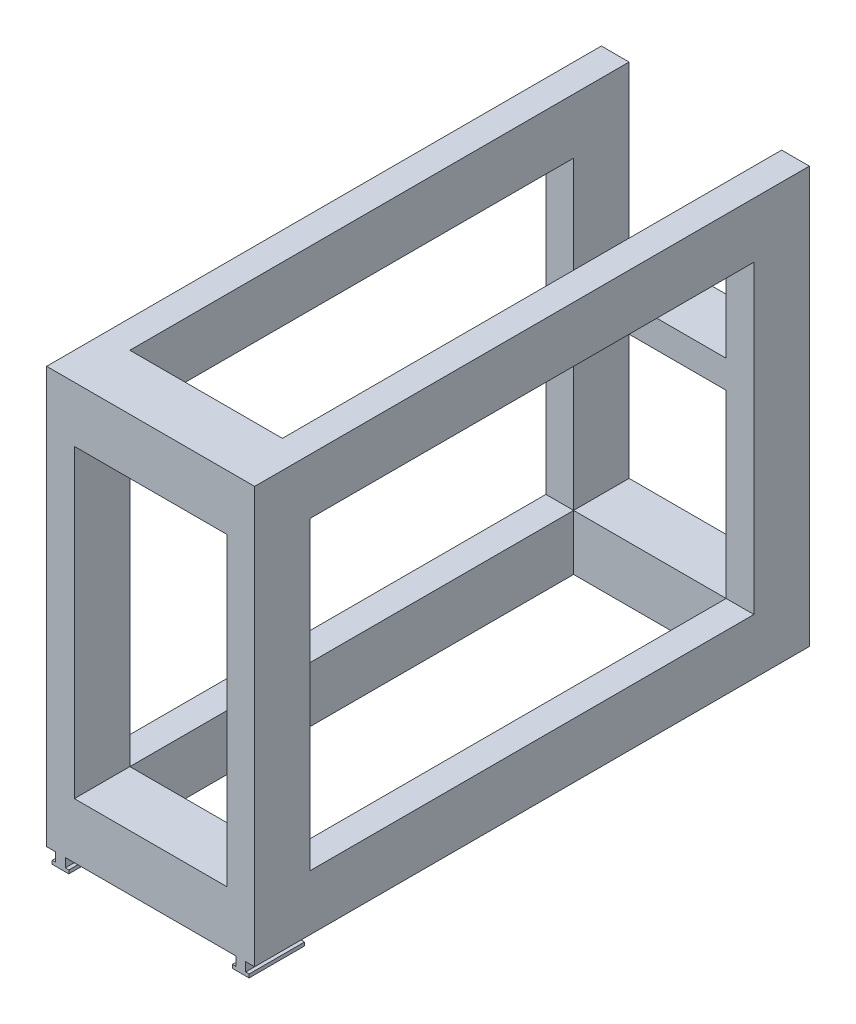
from build123d import *

# Parameters (mm, degrees)
SKETCH3_W           = 190.5
SKETCH3_H           = 508
BOSS_EXTRUDE1_DEPTH = 381
SKETCH4_W           = 406.4
SKETCH4_H           = 279.4
CUT_EXTRUDE1_DEPTH  = 381
SKETCH5_W           = 139.7
SKETCH5_H           = 279.4
CUT_EXTRUDE2_DEPTH  = 924.052
SKETCH6_W           = 139.7
SKETCH6_H           = 406.4
CUT_EXTRUDE3_DEPTH  = 924.052
SKETCH7_W           = 8.89
SKETCH7_H           = 50.8
BOSS_EXTRUDE2_DEPTH = 11.43
SKETCH8_W           = 50.8
SKETCH8_H           = 3.175
BOSS_EXTRUDE3_DEPTH = 3.175
SKETCH9_W           = 50.8
SKETCH9_H           = 3.175
BOSS_EXTRUDE4_DEPTH = 3.175
BOSS_EXTRUDE6_REACH = 488.76
SKETCH11_W          = 50.8
SKETCH11_H          = 25.4
CUT_EXTRUDE4_REACH  = 479.064
SKETCH12_W          = 139.7
SKETCH12_H          = 50.8


with BuildPart() as part:
    # Sketch3 → Boss-Extrude1 (new body)
    with BuildSketch(Plane(origin=(0, 0, 0), x_dir=(1, 0, 0), z_dir=(0, 1, 0))):
        Rectangle(SKETCH3_W, SKETCH3_H)
    extrude(amount=BOSS_EXTRUDE1_DEPTH)

    # Sketch4 → Cut-Extrude1 (cut)
    with BuildSketch(Plane(origin=(95.25, 0, 0), x_dir=(0, 0, -1), z_dir=(1, 0, 0))):
        with Locations((0, 190.5)):
            Rectangle(SKETCH4_W, SKETCH4_H)
    extrude(amount=-CUT_EXTRUDE1_DEPTH, mode=Mode.SUBTRACT)

    # Sketch5 → Cut-Extrude2 (cut)
    with BuildSketch(Plane(origin=(0, 0, -254), x_dir=(-1, 0, 0), z_dir=(0, 0, -1))):
        with Locations((0, 190.5)):
            Rectangle(SKETCH5_W, SKETCH5_H)
    extrude(amount=-CUT_EXTRUDE2_DEPTH, mode=Mode.SUBTRACT)

    # Sketch6 → Cut-Extrude3 (cut)
    with BuildSketch(Plane(origin=(0, 381, 0), x_dir=(1, 0, 0), z_dir=(0, 1, 0))):
        Rectangle(SKETCH6_W, SKETCH6_H)
    extrude(amount=-CUT_EXTRUDE3_DEPTH, mode=Mode.SUBTRACT)

    # Sketch7 → Boss-Extrude2 (add)
    with BuildSketch(Plane.XZ):
        with Locations((-82.55, 228.6)):
            Rectangle(SKETCH7_W, SKETCH7_H)
    boss_extrude2 = extrude(amount=BOSS_EXTRUDE2_DEPTH)

    # Sketch8 → Boss-Extrude3 (add)
    with BuildSketch(Plane(origin=(-78.105, 0, 0), x_dir=(0, 0, -1), z_dir=(1, 0, 0))):
        with Locations((-228.6, -9.8425)):
            Rectangle(SKETCH8_W, SKETCH8_H)
    boss_extrude3 = extrude(amount=BOSS_EXTRUDE3_DEPTH)

    # Sketch9 → Boss-Extrude4 (add)
    with BuildSketch(Plane.ZY.offset(86.995)):
        with Locations((228.6, -9.8425)):
            Rectangle(SKETCH9_W, SKETCH9_H)
    boss_extrude4 = extrude(amount=BOSS_EXTRUDE4_DEPTH)

    # Mirror1: Boss-Extrude2, Boss-Extrude3, Boss-Extrude4 across plane
    add(boss_extrude2.mirror(Plane(origin=(0, 0, 0), x_dir=(0, 0, 1), z_dir=(1, 0, 0))))
    add(boss_extrude3.mirror(Plane(origin=(0, 0, 0), x_dir=(0, 0, 1), z_dir=(1, 0, 0))))
    add(boss_extrude4.mirror(Plane(origin=(0, 0, 0), x_dir=(0, 0, 1), z_dir=(1, 0, 0))))

    # Sketch11 → Boss-Extrude6 (add, up to next)
    with BuildSketch(Plane(origin=(-69.85, 0, 0), x_dir=(0, 0, -1), z_dir=(1, 0, 0)), mode=Mode.PRIVATE) as boss_extrude6_sk1:
        with Locations((228.6, 228.6)):
            Rectangle(SKETCH11_W, SKETCH11_H)
    boss_extrude6_tool1 = extrude(boss_extrude6_sk1.sketch, amount=BOSS_EXTRUDE6_REACH, mode=Mode.PRIVATE) - part.part
    add(boss_extrude6_tool1.solids().sort_by_distance((-69.85, 228.6, -228.6))[0])

    # Sketch12 → Cut-Extrude4 (cut, up to next)
    with BuildSketch(Plane(origin=(0, 381, 0), x_dir=(1, 0, 0), z_dir=(0, 1, 0)), mode=Mode.PRIVATE) as cut_extrude4_sk1:
        with Locations((0, 228.6)):
            Rectangle(SKETCH12_W, SKETCH12_H)
    cut_extrude4_tool1 = extrude(cut_extrude4_sk1.sketch, amount=-CUT_EXTRUDE4_REACH, mode=Mode.PRIVATE) & part.part
    add(cut_extrude4_tool1.solids().sort_by_distance((0, 381, -228.6))[0], mode=Mode.SUBTRACT)


solid = part.part
